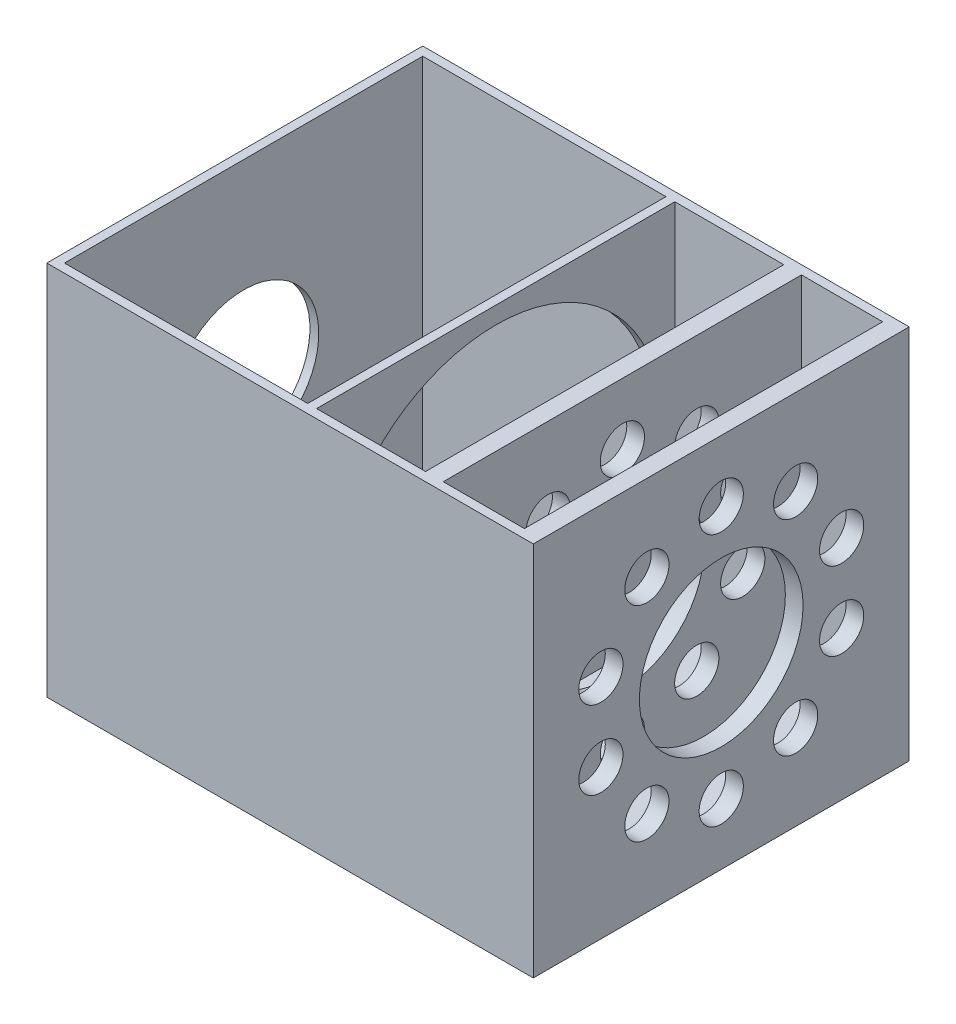
from build123d import *

# Parameters (mm, degrees)
SKETCH1_W           = 110
SKETCH1_H           = 85
BOSS_EXTRUDE1_DEPTH = 85
SKETCH4_W           = 55
SKETCH4_H           = 81
SKETCH4_W_2         = 24.644091747
SKETCH4_W_3         = 18.355908253
CUT_EXTRUDE1_DEPTH  = 83
SKETCH3_R           = 18.5
CUT_EXTRUDE2_DEPTH  = 30
SKETCH2_R           = 17
CUT_EXTRUDE3_DEPTH  = 2
SKETCH6_R           = 37.5
CUT_EXTRUDE4_DEPTH  = 2
SKETCH3_3_R         = 18.5
SKETCH3_3_R_2       = 5
CUT_EXTRUDE5_DEPTH  = 40


with BuildPart() as part:
    # Sketch1 → Boss-Extrude1 (new body)
    with BuildSketch(Plane(origin=(0, 0, 0), x_dir=(1, 0, 0), z_dir=(0, 1, 0))):
        with Locations((55, 42.5)):
            Rectangle(SKETCH1_W, SKETCH1_H)
    extrude(amount=BOSS_EXTRUDE1_DEPTH)

    # Sketch4 → Cut-Extrude1 (cut)
    with BuildSketch(Plane(origin=(0, 85, 0), x_dir=(1, 0, 0), z_dir=(0, 1, 0))):
        with Locations((29.5, 42.5)):
            Rectangle(SKETCH4_W, SKETCH4_H)
        with Locations((71.322045874, 42.5)):
            Rectangle(SKETCH4_W_2, SKETCH4_H)
        with Locations((96.822045874, 42.5)):
            Rectangle(SKETCH4_W_3, SKETCH4_H)
    extrude(amount=-CUT_EXTRUDE1_DEPTH, mode=Mode.SUBTRACT)

    # Sketch3 → Cut-Extrude2 (cut)
    with BuildSketch(Plane(origin=(110, 0, 0), x_dir=(0, 0, -1), z_dir=(1, 0, 0))):
        with Locations((42.5, 42.5)):
            Circle(SKETCH3_R)
    extrude(amount=-CUT_EXTRUDE2_DEPTH, mode=Mode.SUBTRACT)

    # Sketch2 → Cut-Extrude3 (cut)
    with BuildSketch(Plane.ZY):
        with Locations((-42.5, 42.5)):
            Circle(SKETCH2_R)
    extrude(amount=-CUT_EXTRUDE3_DEPTH, mode=Mode.SUBTRACT)

    # Sketch6 → Cut-Extrude4 (cut)
    with BuildSketch(Plane.ZY.offset(-57)):
        with Locations((-42.513147441, 43.61936315)):
            Circle(SKETCH6_R)
    extrude(amount=-CUT_EXTRUDE4_DEPTH, mode=Mode.SUBTRACT)

    # Sketch3<3> → Cut-Extrude5 (cut)
    with BuildSketch(Plane(origin=(110, 0, 0), x_dir=(0, 0, -1), z_dir=(1, 0, 0))):
        with Locations((42.5, 42.5)):
            Circle(SKETCH3_3_R)
        with Locations((42.5, 71.119374851)):
            Circle(SKETCH3_3_R_2)
        with Locations((59.322046467, 65.653560623)):
            Circle(SKETCH3_3_R_2)
        with Locations((69.718642944, 51.343873197)):
            Circle(SKETCH3_3_R_2)
        with Locations((69.718642944, 33.656126803)):
            Circle(SKETCH3_3_R_2)
        with Locations((59.322046467, 19.346439377)):
            Circle(SKETCH3_3_R_2)
        with Locations((42.5, 13.880625149)):
            Circle(SKETCH3_3_R_2)
        with Locations((25.677953533, 19.346439377)):
            Circle(SKETCH3_3_R_2)
        with Locations((15.281357056, 33.656126803)):
            Circle(SKETCH3_3_R_2)
        with Locations((15.281357056, 51.343873197)):
            Circle(SKETCH3_3_R_2)
        with Locations((25.677953533, 65.653560623)):
            Circle(SKETCH3_3_R_2)
    extrude(amount=-CUT_EXTRUDE5_DEPTH, mode=Mode.SUBTRACT)


solid = part.part
